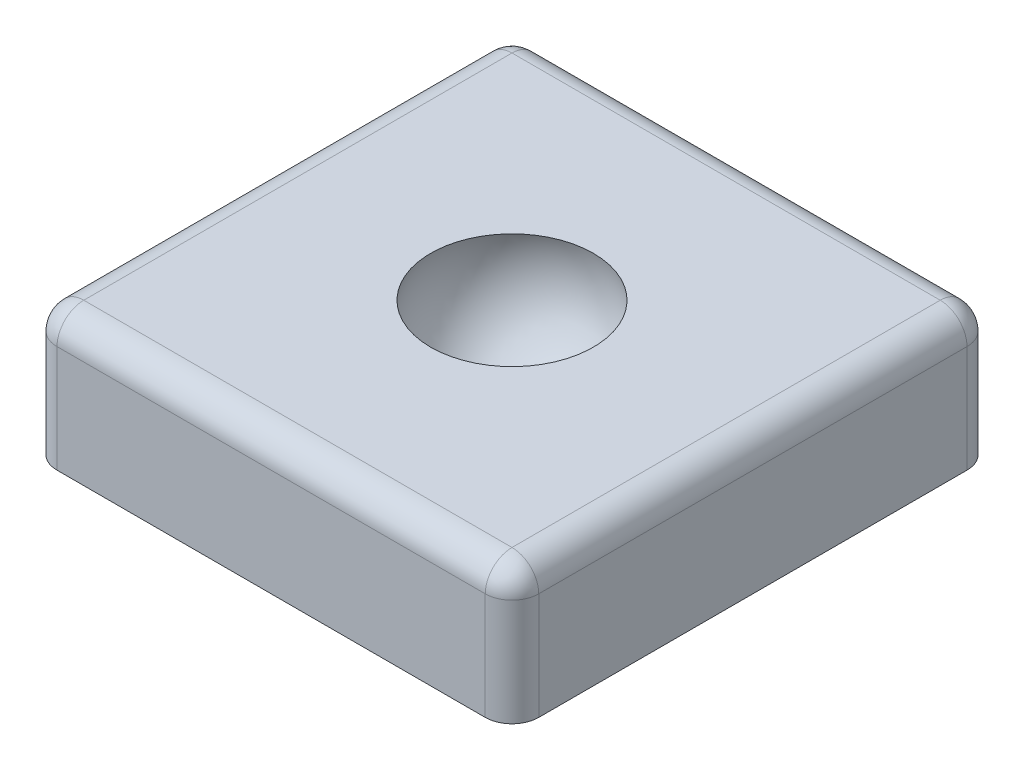
from build123d import *

# Parameters (mm, degrees)
SKETCH_1_W      = 36
SKETCH_1_H      = 36
EXTRUDE_1_DEPTH = 10
FILLET_2_R      = 2


with BuildPart() as part:
    # Эскиз1 → Бобышка-Вытянуть1 (new body)
    with BuildSketch(Plane(origin=(0, 0, 0), x_dir=(1, 0, 0), z_dir=(0, 1, 0))):
        Rectangle(SKETCH_1_W, SKETCH_1_H)
    extrude(amount=EXTRUDE_1_DEPTH)

    # Эскиз4 → Вырез-Повернуть2 (revolve, cut)
    with BuildSketch(Plane(origin=(0, 8, 0), x_dir=(1, 0, 0), z_dir=(0, 1, 0))):
        with BuildLine():
            Line((-6.4, 0), (6.4, 0))
            ThreePointArc((6.4, 0), (0, 6.4), (-6.4, 0))
        make_face()
    revolve(axis=Axis((-23.513868144, 8, 0), (1, 0, 0)), mode=Mode.SUBTRACT)

    # Скругление2
    fillet_2_edges = [part.edges().sort_by_distance(p)[0] for p in [
        (-18, 10, 0),
        (0, 10, 18),
        (18, 10, 0),
        (18, 5, 18),
        (-18, 5, 18),
        (-18, 5, -18),
        (18, 5, -18),
        (0, 10, -18),
    ]]
    fillet(fillet_2_edges, radius=FILLET_2_R)


solid = part.part
